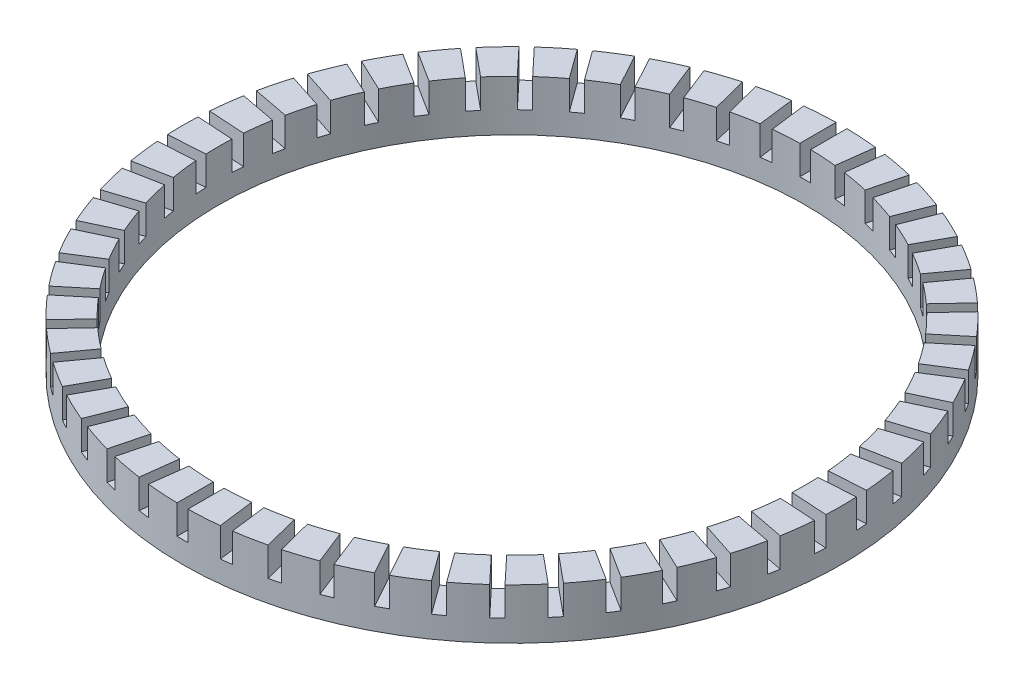
from build123d import *

# Parameters (mm, degrees)
SKETCH1_R           = 45.5
SKETCH1_R_2         = 40.5
BOSS_EXTRUDE1_DEPTH = 7
SKETCH2_W           = 1.5
SKETCH2_H           = 12
CUT_EXTRUDE1_DEPTH  = 4
CIRPATTERN1_COUNT   = 50


with BuildPart() as part:
    # Sketch1 → Boss-Extrude1 (new body)
    with BuildSketch(Plane(origin=(0, 0, 0), x_dir=(1, 0, 0), z_dir=(0, 1, 0))):
        with Locations(Location((0, 0, 0), (0, 0, 270))):
            Circle(SKETCH1_R)
        with Locations(Location((0, 0, 0), (0, 0, 270))):
            Circle(SKETCH1_R_2, mode=Mode.SUBTRACT)
    extrude(amount=BOSS_EXTRUDE1_DEPTH)

    # Sketch2 → Cut-Extrude1 (cut)
    with BuildSketch(Plane(origin=(0, 7, 0), x_dir=(1, 0, 0), z_dir=(0, 1, 0))):
        with Locations((0, 42.433439106)):
            Rectangle(SKETCH2_W, SKETCH2_H)
    cut_extrude1 = extrude(amount=-CUT_EXTRUDE1_DEPTH, mode=Mode.SUBTRACT)

    # CirPattern1: Cut-Extrude1 ×50 about axis
    cirpattern1_axis = Axis((0, 0, 0), (0, 1, 0))
    for i in range(1, CIRPATTERN1_COUNT):
        add(cut_extrude1.rotate(cirpattern1_axis, i * 360 / CIRPATTERN1_COUNT), mode=Mode.SUBTRACT)


solid = part.part
